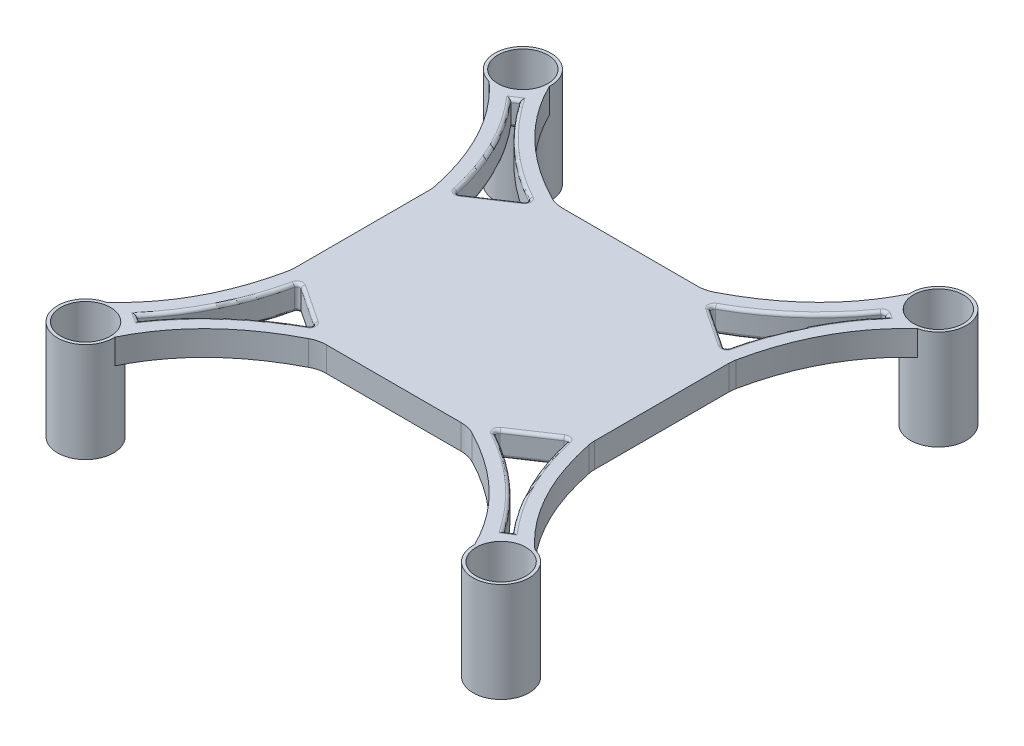
from build123d import *

# Parameters (mm, degrees)
BOSS_EXTRUDE3_DEPTH = 4
CUT_EXTRUDE3_DEPTH  = 4
SKETCH7_R           = 4.5
CUT_EXTRUDE5_DEPTH  = 4
SKETCH9_R           = 4.5
BOSS_EXTRUDE4_DEPTH = 16
SKETCH10_R          = 4
CUT_EXTRUDE6_DEPTH  = 16
FILLET1_R           = 0.5


with BuildPart() as part:
    # Sketch1 → Boss-Extrude3 (new body)
    with BuildSketch(Plane(origin=(0, 0, 0), x_dir=(1, 0, 0), z_dir=(0, 1, 0))):
        with BuildLine():
            Line((10.816365021, 24.687913091), (-10.816365021, 24.687913091))
            ThreePointArc((-10.816365021, 24.687913091), (-11.99989632, 24.830006786), (-13.116158684, 25.248211625))
            add(Edge.make_bspline(
                [(-13.116158684, 25.248211625), (-17.124366696, 27.324488929), (-23.892826516, 32.253661399), (-28.165373926, 38.736069592), (-29.67766953, 42.365582621)],
                knots=[0.037225127, 0.037225127, 0.037225127, 0.037225127, 0.443973259, 0.850721392, 0.850721392, 0.850721392, 0.850721392], degree=3))
            ThreePointArc((-29.67766953, 42.365582621), (-35.771138281, 44.026251657), (-35.878486383, 37.711454791))
            add(Edge.make_bspline(
                [(-24.173701686, 17.548341486), (-25.054807326, 21.765695386), (-27.883651145, 29.448813921), (-32.815807056, 35.245608455), (-35.878486383, 37.711454791)],
                knots=[0.053222064, 0.053222064, 0.053222064, 0.053222064, 0.443973259, 0.850721392, 0.850721392, 0.850721392, 0.850721392], degree=3))
            ThreePointArc((-24.173701686, 17.548341486), (-24.094515064, 17.039794095), (-24.068025967, 16.525800615))
            Line((-24.068025967, 16.525800615), (-24.068025967, -5.106929425))
            ThreePointArc((-24.068025967, -5.106929425), (-24.094515064, -5.620922905), (-24.173701686, -6.129470296))
            add(Edge.make_bspline(
                [(-24.173701686, -6.129470296), (-25.054807326, -10.346824196), (-27.883651145, -18.029942731), (-32.815807056, -23.826737265), (-35.878486383, -26.292583601)],
                knots=[0.053222064, 0.053222064, 0.053222064, 0.053222064, 0.443973259, 0.850721392, 0.850721392, 0.850721392, 0.850721392], degree=3))
            ThreePointArc((-35.878486383, -26.292583601), (-35.771138281, -32.607380466), (-29.67766953, -30.94671143))
            add(Edge.make_bspline(
                [(-13.116158684, -13.829340435), (-17.124366696, -15.905617739), (-23.892826516, -20.834790208), (-28.165373926, -27.317198402), (-29.67766953, -30.94671143)],
                knots=[0.037225127, 0.037225127, 0.037225127, 0.037225127, 0.443973259, 0.850721392, 0.850721392, 0.850721392, 0.850721392], degree=3))
            ThreePointArc((-13.116158684, -13.829340435), (-11.99989632, -13.411135596), (-10.816365021, -13.269041901))
            Line((-10.816365021, -13.269041901), (10.816365021, -13.269041901))
            ThreePointArc((10.816365021, -13.269041901), (11.99989632, -13.411135596), (13.116158684, -13.829340435))
            add(Edge.make_bspline(
                [(13.116158684, -13.829340435), (17.124366696, -15.905617739), (23.892826516, -20.834790208), (28.165373926, -27.317198402), (29.67766953, -30.94671143)],
                knots=[0.037225127, 0.037225127, 0.037225127, 0.037225127, 0.443973259, 0.850721392, 0.850721392, 0.850721392, 0.850721392], degree=3))
            ThreePointArc((29.67766953, -30.94671143), (35.771138281, -32.607380466), (35.878486383, -26.292583601))
            add(Edge.make_bspline(
                [(24.173701686, -6.129470296), (25.054807326, -10.346824196), (27.883651145, -18.029942731), (32.815807056, -23.826737265), (35.878486383, -26.292583601)],
                knots=[0.053222064, 0.053222064, 0.053222064, 0.053222064, 0.443973259, 0.850721392, 0.850721392, 0.850721392, 0.850721392], degree=3))
            ThreePointArc((24.173701686, -6.129470296), (24.094515064, -5.620922905), (24.068025967, -5.106929425))
            Line((24.068025967, -5.106929425), (24.068025967, 16.525800615))
            ThreePointArc((24.068025967, 16.525800615), (24.094515064, 17.039794095), (24.173701686, 17.548341486))
            add(Edge.make_bspline(
                [(24.173701686, 17.548341486), (25.054807326, 21.765695386), (27.883651145, 29.448813921), (32.815807056, 35.245608455), (35.878486383, 37.711454791)],
                knots=[0.053222064, 0.053222064, 0.053222064, 0.053222064, 0.443973259, 0.850721392, 0.850721392, 0.850721392, 0.850721392], degree=3))
            ThreePointArc((35.878486383, 37.711454791), (35.771138281, 44.026251657), (29.67766953, 42.365582621))
            add(Edge.make_bspline(
                [(13.116158684, 25.248211625), (17.124366696, 27.324488929), (23.892826516, 32.253661399), (28.165373926, 38.736069592), (29.67766953, 42.365582621)],
                knots=[0.037225127, 0.037225127, 0.037225127, 0.037225127, 0.443973259, 0.850721392, 0.850721392, 0.850721392, 0.850721392], degree=3))
            ThreePointArc((13.116158684, 25.248211625), (11.99989632, 24.830006786), (10.816365021, 24.687913091))
        make_face()
    extrude(amount=BOSS_EXTRUDE3_DEPTH)

    # Sketch5 → Cut-Extrude3 (cut)
    with BuildSketch(Plane(origin=(0, 4, 0), x_dir=(1, 0, 0), z_dir=(0, 1, 0))):
        with BuildLine():
            Line((30.197688128, 35.734010865), (29.322531315, 36.290641289))
            ThreePointArc((29.322531315, 36.290641289), (22.607925527, 28.73579628), (14.266055516, 23.028360892))
            Line((14.266055516, 23.028360892), (21.726539546, 18.059611922))
            ThreePointArc((21.726539546, 18.059611922), (24.830631558, 27.439118633), (30.197688128, 35.734010865))
        make_face()
        with BuildLine():
            Line((-30.197688128, 35.734010865), (-29.322531315, 36.290641289))
            ThreePointArc((-29.322531315, 36.290641289), (-22.607925527, 28.73579628), (-14.266055516, 23.028360892))
            Line((-14.266055516, 23.028360892), (-21.726539546, 18.059611922))
            ThreePointArc((-21.726539546, 18.059611922), (-24.830631558, 27.439118633), (-30.197688128, 35.734010865))
        make_face()
        with BuildLine():
            Line((30.197688128, -24.315139675), (29.322531315, -24.871770099))
            ThreePointArc((29.322531315, -24.871770099), (22.607925527, -17.31692509), (14.266055516, -11.609489702))
            Line((14.266055516, -11.609489702), (21.726539546, -6.640740731))
            ThreePointArc((21.726539546, -6.640740731), (24.830631558, -16.020247443), (30.197688128, -24.315139675))
        make_face()
        with BuildLine():
            Line((-14.266055516, -11.609489702), (-21.726539546, -6.640740731))
            ThreePointArc((-21.726539546, -6.640740731), (-24.830631558, -16.020247443), (-30.197688128, -24.315139675))
            Line((-30.197688128, -24.315139675), (-29.322531315, -24.871770099))
            ThreePointArc((-29.322531315, -24.871770099), (-22.607925527, -17.31692509), (-14.266055516, -11.609489702))
        make_face()
    extrude(amount=-CUT_EXTRUDE3_DEPTH, mode=Mode.SUBTRACT)

    # Sketch7 → Cut-Extrude5 (cut)
    with BuildSketch(Plane(origin=(0, 4, 0), x_dir=(1, 0, 0), z_dir=(0, 1, 0))):
        with Locations((33.369977761, 40.827122375)):
            Circle(SKETCH7_R)
        with Locations((-33.369977761, 40.827122375)):
            Circle(SKETCH7_R)
        with Locations((33.369977761, -29.408251185)):
            Circle(SKETCH7_R)
        with Locations((-33.369977761, -29.408251185)):
            Circle(SKETCH7_R)
    extrude(amount=-CUT_EXTRUDE5_DEPTH, mode=Mode.SUBTRACT)

    # Sketch9 → Boss-Extrude4 (add)
    with BuildSketch(Plane(origin=(0, 4, 0), x_dir=(1, 0, 0), z_dir=(0, 1, 0))):
        with Locations(Location((33.369977761, 40.827122375, 0), (0, 0, 270))):
            Circle(SKETCH9_R)
        with Locations(Location((-33.369977761, 40.827122375, 0), (0, 0, 256.723078695))):
            Circle(SKETCH9_R)
        with Locations(Location((33.369977761, -29.408251185, 0), (0, 0, 177.058280304))):
            Circle(SKETCH9_R)
        with Locations(Location((-33.369977761, -29.408251185, 0), (0, 0, 270))):
            Circle(SKETCH9_R)
    extrude(amount=-BOSS_EXTRUDE4_DEPTH)

    # Sketch10 → Cut-Extrude6 (cut)
    with BuildSketch(Plane(origin=(0, 4, 0), x_dir=(1, 0, 0), z_dir=(0, 1, 0))):
        with Locations(Location((33.369977761, 40.827122375, 0), (0, 0, 270))):
            Circle(SKETCH10_R)
        with Locations(Location((-33.369977761, 40.827122375, 0), (0, 0, 90))):
            Circle(SKETCH10_R)
        with Locations(Location((33.369977761, -29.408251185, 0), (0, 0, 90))):
            Circle(SKETCH10_R)
        with Locations(Location((-33.369977761, -29.408251185, 0), (0, 0, 270))):
            Circle(SKETCH10_R)
    extrude(amount=-CUT_EXTRUDE6_DEPTH, mode=Mode.SUBTRACT)

    # Fillet1
    fillet1_edges = [part.edges().sort_by_distance(p)[0] for p in [
        (-17.996297531, 0, 9.125115217),
        (-21.726539546, 2, 6.640740731),
        (-22.607925527, 4, 17.31692509),
        (-14.266055516, 2, 11.609489702),
        (-29.760109722, 0, 24.593454887),
        (-24.830631558, 0, 16.020247443),
        (-22.607925527, 0, 17.31692509),
        (-17.996297531, 4, 9.125115217),
        (-24.830631558, 4, 16.020247443),
        (-29.760109722, 4, 24.593454887),
        (17.996297531, 4, 9.125115217),
        (14.266055516, 2, 11.609489702),
        (24.830631558, 4, 16.020247443),
        (21.726539546, 2, 6.640740731),
        (29.760109722, 4, 24.593454887),
        (22.607925527, 0, 17.31692509),
        (17.996297531, 0, 9.125115217),
        (24.830631558, 0, 16.020247443),
        (29.760109722, 0, 24.593454887),
        (22.607925527, 4, 17.31692509),
        (22.607925527, 4, -28.73579628),
        (14.266055516, 2, -23.028360892),
        (29.760109722, 0, -36.012326077),
        (29.322531315, 2, -36.290641289),
        (24.830631558, 0, -27.439118633),
        (17.996297531, 0, -20.543986407),
        (21.726539546, 2, -18.059611922),
        (22.607925527, 0, -28.73579628),
        (17.996297531, 4, -20.543986407),
        (24.830631558, 4, -27.439118633),
        (29.760109722, 4, -36.012326077),
        (-17.996297531, 4, -20.543986407),
        (-14.266055516, 2, -23.028360892),
        (-24.830631558, 4, -27.439118633),
        (-21.726539546, 2, -18.059611922),
        (-29.760109722, 4, -36.012326077),
        (-22.607925527, 0, -28.73579628),
        (-17.996297531, 0, -20.543986407),
        (-24.830631558, 0, -27.439118633),
        (-29.760109722, 0, -36.012326077),
        (-22.607925527, 4, -28.73579628),
    ]]
    fillet(fillet1_edges, radius=FILLET1_R)


solid = part.part
